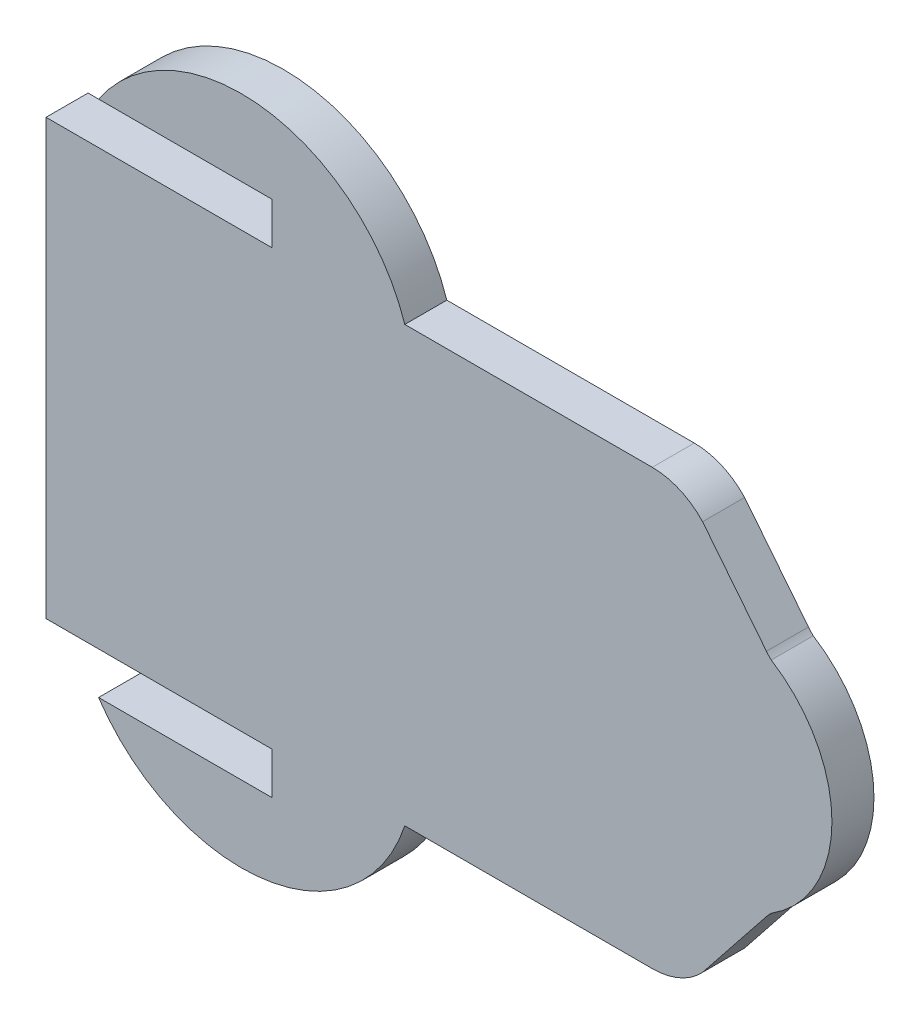
from build123d import *

# Parameters (mm, degrees)
BASE_EXTRUDE_DEPTH = 3


with BuildPart() as part:
    # Sketch1 → Base-Extrude (new body)
    with BuildSketch(Plane.XY):
        with BuildLine():
            Line((534.507066227, 1.566585982), (534.507066227, -29.433414018))
            Line((534.507066227, -29.433414018), (550.643129996, -29.433414018))
            Line((550.643129996, -29.433414018), (550.643129996, -32.433414018))
            Line((550.643129996, -32.433414018), (538.258588448, -32.433414018))
            ThreePointArc((538.258588448, -32.433414018), (550.12702098, -37.759556083), (560.122161718, -29.433414018))
            Line((560.122161718, -29.433414018), (577.454155209, -29.433414018))
            Line((577.454155209, -29.433414018), (577.793445205, -29.433414018))
            ThreePointArc((577.793445205, -29.433414018), (579.752044999, -29.024576285), (581.383534897, -27.866343942))
            Line((581.383534897, -27.866343942), (585.943497105, -22.135687625))
            ThreePointArc((585.943497105, -22.135687625), (586.10909179, -21.942450413), (586.288300693, -21.761767294))
            ThreePointArc((586.288300693, -21.761767294), (590.621491518, -13.933414018), (586.288300693, -6.105060742))
            ThreePointArc((586.288300693, -6.105060742), (586.10909179, -5.924377623), (585.943497105, -5.731140411))
            Line((585.943497105, -5.731140411), (581.383534897, -0.000484094))
            ThreePointArc((581.383534897, -0.000484094), (579.752044999, 1.157748249), (577.793445205, 1.566585982))
            Line((577.793445205, 1.566585982), (577.454155209, 1.566585982))
            Line((577.454155209, 1.566585982), (560.122161718, 1.566585982))
            ThreePointArc((560.122161718, 1.566585982), (550.12702098, 9.892728047), (538.258588448, 4.566585982))
            Line((538.258588448, 4.566585982), (550.643129996, 4.566585982))
            Line((550.643129996, 4.566585982), (550.643129996, 1.566585982))
            Line((550.643129996, 1.566585982), (534.507066227, 1.566585982))
        make_face()
    extrude(amount=BASE_EXTRUDE_DEPTH)


solid = part.part
